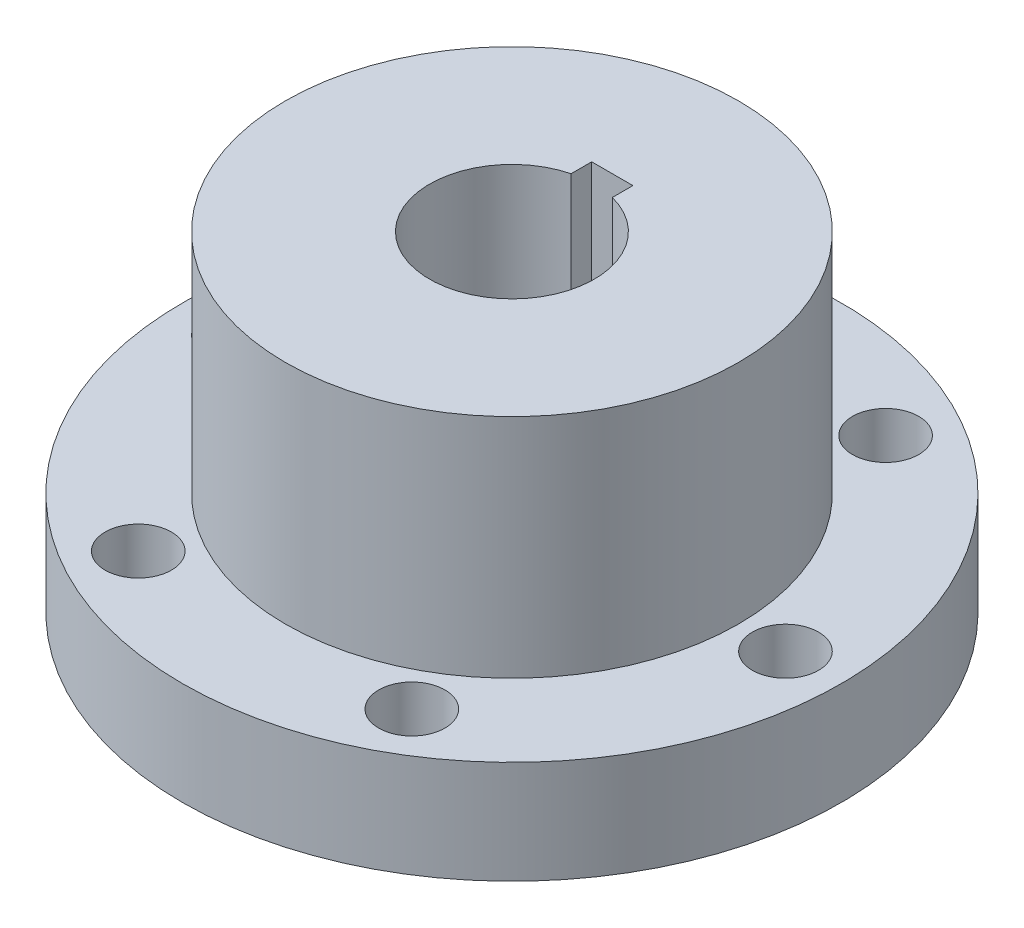
from build123d import *

# Parameters (mm, degrees)
SKETCH1_R              = 25.4
BOSS_EXTRUDE1_DEPTH    = 25.4
CUT_EXTRUDE1_START     = -17.4625
SKETCH2_R              = 25.4
SKETCH2_R_2            = 17.4625
CUT_EXTRUDE1_DEPTH     = 17.4625
CUT_EXTRUDE2_DEPTH     = 44.994090512
F_10_CLEARANCE_HOLE1_D = 5.1054


with BuildPart() as part:
    # Sketch1 → Boss-Extrude1 (new body)
    with BuildSketch(Plane(origin=(0, 0, 0), x_dir=(1, 0, 0), z_dir=(0, 1, 0))):
        with Locations(Location((0, 0, 0), (0, 0, 270))):
            Circle(SKETCH1_R)
    extrude(amount=BOSS_EXTRUDE1_DEPTH)

    # Sketch2 → Cut-Extrude1 (cut)
    with BuildSketch(Plane(origin=(0, 25.4, 0), x_dir=(1, 0, 0), z_dir=(0, 1, 0)).offset(CUT_EXTRUDE1_START)):
        with Locations(Location((0, 0, 0), (0, 0, 270))):
            Circle(SKETCH2_R)
        with Locations(Location((0, 0, 0), (0, 0, 270))):
            Circle(SKETCH2_R_2, mode=Mode.SUBTRACT)
    extrude(amount=CUT_EXTRUDE1_DEPTH, mode=Mode.SUBTRACT)

    # Sketch3 → Cut-Extrude2 (cut, through all)
    with BuildSketch(Plane(origin=(0, 25.4, 0), x_dir=(1, 0, 0), z_dir=(0, 1, 0))):
        with BuildLine():
            ThreePointArc((1.5875, 6.148361062), (0, 6.35), (-1.5875, 6.148361062))
            Line((-1.5875, 6.148361062), (1.5875, 6.148361062))
        make_face()
        with BuildLine():
            Line((1.5875, 6.148361062), (-1.5875, 6.148361062))
            ThreePointArc((-1.5875, 6.148361062), (-3.888564967, -5.020115786), (6.35, 0))
            ThreePointArc((6.35, 0), (5.020115786, 3.888564967), (1.5875, 6.148361062))
        make_face()
        with BuildLine():
            Line((-1.5875, 7.735861062), (-1.5875, 6.148361062))
            ThreePointArc((-1.5875, 6.148361062), (0, 6.35), (1.5875, 6.148361062))
            Line((1.5875, 6.148361062), (1.5875, 7.735861062))
            Line((1.5875, 7.735861062), (-1.5875, 7.735861062))
        make_face()
    extrude(amount=-CUT_EXTRUDE2_DEPTH, mode=Mode.SUBTRACT)

    # #10 Clearance Hole1 (through all)
    with Locations(Plane(origin=(21.082, 7.9375, 0), x_dir=(0, 0, 1), z_dir=(0, 1, 0))):
        with Locations((0, 0), (-18.257547563, -10.541), (-18.257547563, -31.623), (0, -42.164), (18.257547563, -31.623), (18.257547563, -10.541)):
            Hole(F_10_CLEARANCE_HOLE1_D / 2)


solid = part.part
